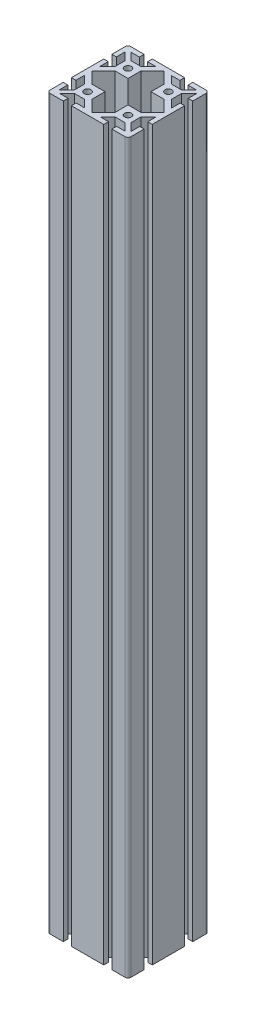
from build123d import *

# Parameters (mm, degrees)
SKETCH2_R                           = 3.35
F_80_SERIES_TS80_80M_650039_2_DEPTH = 720
M8X1_25_TAPPED_HOLE2_D              = 6.8
M8X1_25_TAPPED_HOLE2_DEPTH          = 25
M8X1_25_TAPPED_HOLE2_TIP            = 2.042926105
M8X1_25_TAPPED_HOLE3_D              = 6.8
M8X1_25_TAPPED_HOLE3_DEPTH          = 25
M8X1_25_TAPPED_HOLE3_TIP            = 2.042926105


with BuildPart() as part:
    # Sketch2 → 80 series TS80-80M-650039(2) (new body)
    with BuildSketch(Plane(origin=(0, 0, 0), x_dir=(-1, 0, 0), z_dir=(0, 1, 0))):
        with BuildLine():
            Line((-28, 15.179010667), (-28, 24.820989333))
            Line((-28, 24.820989333), (-35.5438, 32.364789333))
            Line((-35.5438, 32.364789333), (-35.5438, 24))
            Line((-35.5438, 24), (-40, 24))
            Line((-40, 24), (-40, 37))
            ThreePointArc((-40, 37), (-39.121320344, 39.121320344), (-37, 40))
            Line((-37, 40), (-24, 40))
            Line((-24, 40), (-24, 35.301))
            Line((-24, 35.301), (-32.121989333, 35.301))
            Line((-32.121989333, 35.301), (-24.820989333, 28))
            Line((-24.820989333, 28), (-15.179010667, 28))
            Line((-15.179010667, 28), (-7.878010667, 35.301))
            Line((-7.878010667, 35.301), (-16, 35.301))
            Line((-16, 35.301), (-16, 40))
            Line((-16, 40), (16, 40))
            Line((16, 40), (16, 35.301))
            Line((16, 35.301), (7.878010667, 35.301))
            Line((7.878010667, 35.301), (15.179010667, 28))
            Line((15.179010667, 28), (24.820989333, 28))
            Line((24.820989333, 28), (32.121989333, 35.301))
            Line((32.121989333, 35.301), (24, 35.301))
            Line((24, 35.301), (24, 40))
            Line((24, 40), (37, 40))
            ThreePointArc((37, 40), (39.121320344, 39.121320344), (40, 37))
            Line((40, 37), (40, 24))
            Line((40, 24), (35.5438, 24))
            Line((35.5438, 24), (35.5438, 32.364789333))
            Line((35.5438, 32.364789333), (28, 24.820989333))
            Line((28, 24.820989333), (28, 15.179010667))
            Line((28, 15.179010667), (35.5438, 7.635210667))
            Line((35.5438, 7.635210667), (35.5438, 16))
            Line((35.5438, 16), (40, 16))
            Line((40, 16), (40, -16))
            Line((40, -16), (35.5438, -16))
            Line((35.5438, -16), (35.5438, -7.635210667))
            Line((35.5438, -7.635210667), (28, -15.179010667))
            Line((28, -15.179010667), (28, -24.820989333))
            Line((28, -24.820989333), (35.5438, -32.364789333))
            Line((35.5438, -32.364789333), (35.5438, -24))
            Line((35.5438, -24), (40, -24))
            Line((40, -24), (40, -37))
            ThreePointArc((40, -37), (39.121320344, -39.121320344), (37, -40))
            Line((37, -40), (24, -40))
            Line((24, -40), (24, -35.301))
            Line((24, -35.301), (32.121989333, -35.301))
            Line((32.121989333, -35.301), (24.820989333, -28))
            Line((24.820989333, -28), (15.179010667, -28))
            Line((15.179010667, -28), (7.878010667, -35.301))
            Line((7.878010667, -35.301), (16, -35.301))
            Line((16, -35.301), (16, -40))
            Line((16, -40), (-16, -40))
            Line((-16, -40), (-16, -35.301))
            Line((-16, -35.301), (-7.878010667, -35.301))
            Line((-7.878010667, -35.301), (-15.179010667, -28))
            Line((-15.179010667, -28), (-24.820989333, -28))
            Line((-24.820989333, -28), (-32.121989333, -35.301))
            Line((-32.121989333, -35.301), (-24, -35.301))
            Line((-24, -35.301), (-24, -40))
            Line((-24, -40), (-37, -40))
            ThreePointArc((-37, -40), (-39.121320344, -39.121320344), (-40, -37))
            Line((-40, -37), (-40, -24))
            Line((-40, -24), (-35.5438, -24))
            Line((-35.5438, -24), (-35.5438, -32.364789333))
            Line((-35.5438, -32.364789333), (-28, -24.820989333))
            Line((-28, -24.820989333), (-28, -15.179010667))
            Line((-28, -15.179010667), (-35.5438, -7.635210667))
            Line((-35.5438, -7.635210667), (-35.5438, -16))
            Line((-35.5438, -16), (-40, -16))
            Line((-40, -16), (-40, 16))
            Line((-40, 16), (-35.5438, 16))
            Line((-35.5438, 16), (-35.5438, 7.635210667))
            Line((-35.5438, 7.635210667), (-28, 15.179010667))
        make_face()
        with Locations((20, -20)):
            Circle(SKETCH2_R, mode=Mode.SUBTRACT)
        with Locations((-20, -20)):
            Circle(SKETCH2_R, mode=Mode.SUBTRACT)
        with Locations((-20, 20)):
            Circle(SKETCH2_R, mode=Mode.SUBTRACT)
        with Locations((20, 20)):
            Circle(SKETCH2_R, mode=Mode.SUBTRACT)
        Polygon((-11.353421559, 24.174410892), (0, 35.527832452), (11.353421559, 24.174410892), (11.353421559, 11.353421559), (24.174410892, 11.353421559), (35.527832452, 0), (24.174410892, -11.353421559), (11.353421559, -11.353421559), (11.353421559, -24.174410892), (0, -35.527832452), (-11.353421559, -24.174410892), (-11.353421559, -11.353421559), (-24.174410892, -11.353421559), (-35.527832452, 0), (-24.174410892, 11.353421559), (-11.353421559, 11.353421559), align=None, mode=Mode.SUBTRACT)
    extrude(amount=F_80_SERIES_TS80_80M_650039_2_DEPTH)

    # M8x1.25 Tapped Hole2
    with Locations(Plane(origin=(0, 0, 0), x_dir=(-1, 0, 0), z_dir=(0, -1, 0))):
        with Locations((-20, 20), (20, 20), (20, -20), (-20, -20)):
            Hole(M8X1_25_TAPPED_HOLE2_D / 2, depth=M8X1_25_TAPPED_HOLE2_DEPTH)
            with Locations((0, 0, -(M8X1_25_TAPPED_HOLE2_DEPTH + M8X1_25_TAPPED_HOLE2_TIP / 2))):  # 118° drill point
                Cone(0, M8X1_25_TAPPED_HOLE2_D / 2, M8X1_25_TAPPED_HOLE2_TIP, mode=Mode.SUBTRACT)

    # M8x1.25 Tapped Hole3
    with Locations(Plane(origin=(0, 720, 0), x_dir=(1, 0, 0), z_dir=(0, 1, 0))):
        with Locations((-20, -20)):
            Hole(M8X1_25_TAPPED_HOLE3_D / 2, depth=M8X1_25_TAPPED_HOLE3_DEPTH)
            with Locations((0, 0, -(M8X1_25_TAPPED_HOLE3_DEPTH + M8X1_25_TAPPED_HOLE3_TIP / 2))):  # 118° drill point
                Cone(0, M8X1_25_TAPPED_HOLE3_D / 2, M8X1_25_TAPPED_HOLE3_TIP, mode=Mode.SUBTRACT)


solid = part.part
